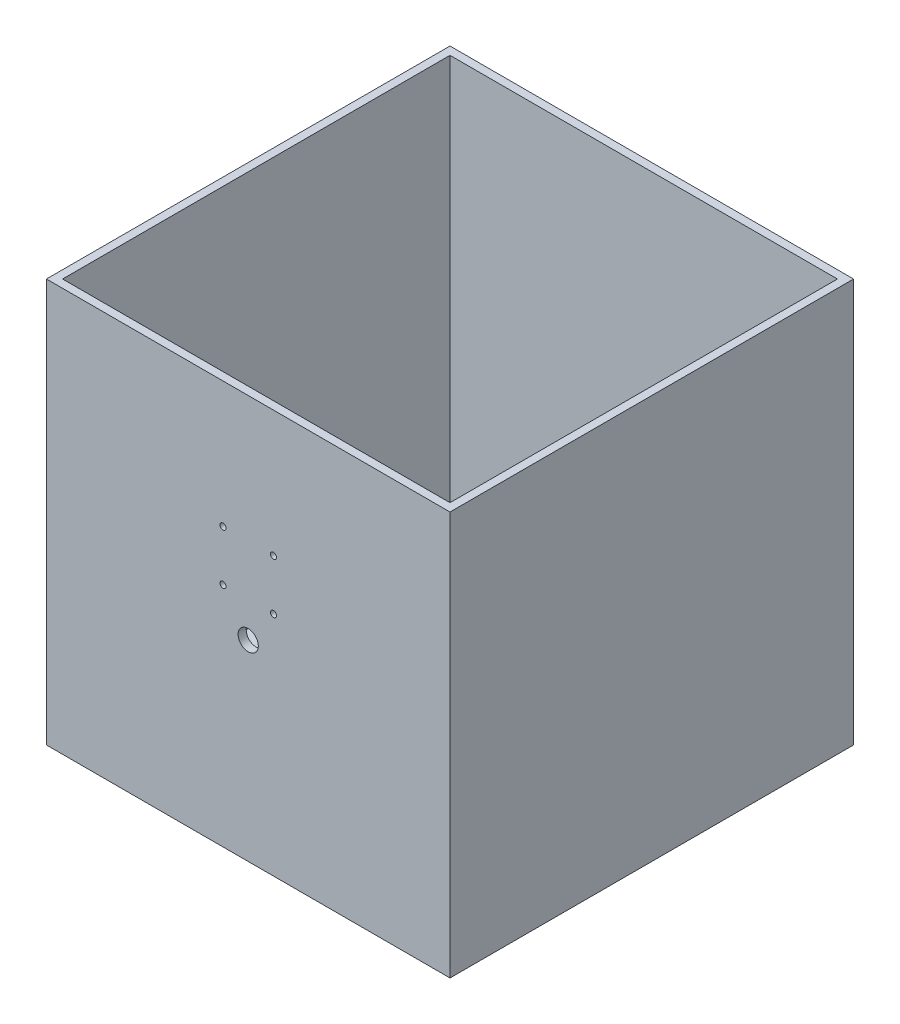
from build123d import *

# Parameters (mm, degrees)
SKETCH1_W           = 200
SKETCH1_H           = 200
BOSS_EXTRUDE1_DEPTH = 200
SHELL1_T            = -4
CUT_EXTRUDE1_REACH  = 302
SKETCH2_R           = 1.5
SKETCH2_R_2         = 5
CUT_EXTRUDE2_REACH  = 302
SKETCH3_R           = 3


with BuildPart() as part:
    # Sketch1 → Boss-Extrude1 (new body)
    with BuildSketch(Plane(origin=(0, 0, 0), x_dir=(1, 0, 0), z_dir=(0, 1, 0))):
        Rectangle(SKETCH1_W, SKETCH1_H)
    extrude(amount=BOSS_EXTRUDE1_DEPTH)

    # Shell1
    shell1_openings = [part.faces().sort_by_distance(p)[0] for p in [
        (0, 200, 0),
    ]]
    offset(amount=SHELL1_T, openings=shell1_openings, kind=Kind.INTERSECTION)

    # Sketch2 → Cut-Extrude1 (cut, up to next)
    with BuildSketch(Plane.XY.offset(100), mode=Mode.PRIVATE) as cut_extrude1_sk1:
        with Locations((-12.5, 137.5)):
            Circle(SKETCH2_R)
    cut_extrude1_tool1 = extrude(cut_extrude1_sk1.sketch, amount=-CUT_EXTRUDE1_REACH, mode=Mode.PRIVATE) & part.part
    # Sketch2 → Cut-Extrude1 (cut, up to next)
    with BuildSketch(Plane.XY.offset(100), mode=Mode.PRIVATE) as cut_extrude1_sk2:
        with Locations((12.5, 137.5)):
            Circle(SKETCH2_R)
    cut_extrude1_tool2 = extrude(cut_extrude1_sk2.sketch, amount=-CUT_EXTRUDE1_REACH, mode=Mode.PRIVATE) & part.part
    # Sketch2 → Cut-Extrude1 (cut, up to next)
    with BuildSketch(Plane.XY.offset(100), mode=Mode.PRIVATE) as cut_extrude1_sk3:
        with Locations((12.5, 112.5)):
            Circle(SKETCH2_R)
    cut_extrude1_tool3 = extrude(cut_extrude1_sk3.sketch, amount=-CUT_EXTRUDE1_REACH, mode=Mode.PRIVATE) & part.part
    # Sketch2 → Cut-Extrude1 (cut, up to next)
    with BuildSketch(Plane.XY.offset(100), mode=Mode.PRIVATE) as cut_extrude1_sk4:
        with Locations((-12.5, 112.5)):
            Circle(SKETCH2_R)
    cut_extrude1_tool4 = extrude(cut_extrude1_sk4.sketch, amount=-CUT_EXTRUDE1_REACH, mode=Mode.PRIVATE) & part.part
    # Sketch2 → Cut-Extrude1 (cut, up to next)
    with BuildSketch(Plane.XY.offset(100), mode=Mode.PRIVATE) as cut_extrude1_sk5:
        with Locations((0, 95)):
            Circle(SKETCH2_R_2)
    cut_extrude1_tool5 = extrude(cut_extrude1_sk5.sketch, amount=-CUT_EXTRUDE1_REACH, mode=Mode.PRIVATE) & part.part
    add(cut_extrude1_tool1.solids().sort_by_distance((-12.5, 137.5, 100))[0], mode=Mode.SUBTRACT)
    add(cut_extrude1_tool2.solids().sort_by_distance((12.5, 137.5, 100))[0], mode=Mode.SUBTRACT)
    add(cut_extrude1_tool3.solids().sort_by_distance((12.5, 112.5, 100))[0], mode=Mode.SUBTRACT)
    add(cut_extrude1_tool4.solids().sort_by_distance((-12.5, 112.5, 100))[0], mode=Mode.SUBTRACT)
    add(cut_extrude1_tool5.solids().sort_by_distance((0, 95, 100))[0], mode=Mode.SUBTRACT)

    # Sketch3 → Cut-Extrude2 (cut, up to next)
    with BuildSketch(Plane.ZY.offset(100), mode=Mode.PRIVATE) as cut_extrude2_sk1:
        with Locations((-70, 15)):
            Circle(SKETCH3_R)
    cut_extrude2_tool1 = extrude(cut_extrude2_sk1.sketch, amount=-CUT_EXTRUDE2_REACH, mode=Mode.PRIVATE) & part.part
    add(cut_extrude2_tool1.solids().sort_by_distance((-100, 15, -70))[0], mode=Mode.SUBTRACT)


solid = part.part
